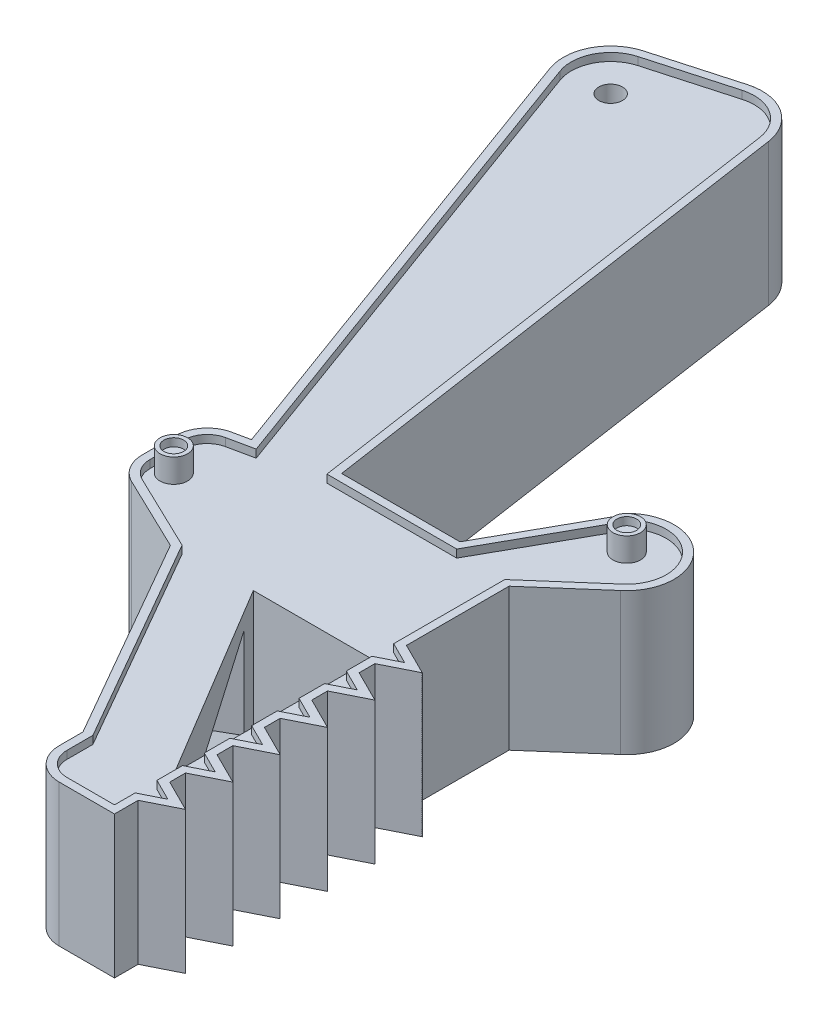
from build123d import *

# Parameters (mm, degrees)
BOSS_EXTRUDE1_DEPTH = 9
FILLET1_R           = 6
FILLET2_R           = 4
BOSS_EXTRUDE2_DEPTH = 18
LPATTERN1_COUNT     = 6
LPATTERN1_PITCH     = 6
CUT_EXTRUDE1_DEPTH  = 26
CUT_EXTRUDE2_DEPTH  = 12
SKETCH6_R           = 1.5
CUT_EXTRUDE3_DEPTH  = 137.617023851
SKETCH7_R           = 1.75
BOSS_EXTRUDE3_DEPTH = 3
SKETCH8_R           = 1.25
CUT_EXTRUDE4_DEPTH  = 1
SKETCH9_R           = 1.25
CUT_EXTRUDE5_DEPTH  = 1
CUT_EXTRUDE6_DEPTH  = 1
CUT_EXTRUDE8_DEPTH  = 1


with BuildPart() as part:
    # Sketch1 → Boss-Extrude1 (new, symmetric)
    with BuildSketch(Plane(origin=(0, 0, 0), x_dir=(1, 0, 0), z_dir=(0, 1, 0))):
        Polygon((-60.65446174, -6.500648573), (-36.587825561, -72.233418354), (-27.166266267, -70.236347784), (-37.55161412, 0), align=None)
        with BuildLine():
            ThreePointArc((-4.305064826, -56.165075387), (4.142121149, -56.968224871), (3.338971664, -65.415410847))
            Line((3.338971664, -65.415410847), (-4.18856152, -71.998437822))
            Line((-4.18856152, -71.998437822), (-4.18856152, -121.998437822))
            Line((-4.18856152, -121.998437822), (-15.18856152, -121.998437822))
            Line((-15.18856152, -121.998437822), (-15.18856152, -114.998437822))
            Line((-15.18856152, -114.998437822), (-30.124544277, -88.980820347))
            Line((-30.124544277, -88.980820347), (-41.840233878, -83.346761671))
            Line((-41.840233878, -83.346761671), (-41.840233878, -73.346761671))
            Line((-41.840233878, -73.346761671), (-27.166266267, -70.236347784))
            Line((-27.166266267, -70.236347784), (-12.168992483, -70.236347784))
            Line((-12.168992483, -70.236347784), (-4.305064826, -56.165075387))
        make_face()
    extrude(amount=BOSS_EXTRUDE1_DEPTH, both=True)

    # Fillet1
    fillet1_edges = [part.edges().sort_by_distance(p)[0] for p in [
        (-60.65446174, 0, 6.500648573),
        (-37.55161412, 0, 0),
    ]]
    fillet(fillet1_edges, radius=FILLET1_R)

    # Fillet2
    fillet2_edges = [part.edges().sort_by_distance(p)[0] for p in [
        (-15.18856152, 0, 121.998437822),
        (-41.840233878, 0, 83.346761671),
        (-41.840233878, 0, 73.346761671),
    ]]
    fillet(fillet2_edges, radius=FILLET2_R)

    # Sketch2 → Boss-Extrude2 (add)
    with BuildSketch(Plane(origin=(0, 9, 0), x_dir=(1, 0, 0), z_dir=(0, 1, 0))):
        Polygon((-4.18856152, -114.998437822), (-4.18856152, -118.998437822), (-0.18856152, -116.998437822), align=None)
    boss_extrude2 = extrude(amount=-BOSS_EXTRUDE2_DEPTH)

    # LPattern1: Boss-Extrude2 ×6
    with Locations(*[(0, 0, -i * LPATTERN1_PITCH) for i in range(1, LPATTERN1_COUNT)]):
        add(boss_extrude2)

    # Sketch3 → Cut-Extrude1 (cut)
    with BuildSketch(Plane(origin=(0, 9, 0), x_dir=(1, 0, 0), z_dir=(0, 1, 0))):
        Polygon((-5.910062362, -112.681899409), (-5.910062362, -87.681899409), (-20.910062362, -87.681899409), align=None)
    extrude(amount=-CUT_EXTRUDE1_DEPTH, mode=Mode.SUBTRACT)

    # Sketch5 → Cut-Extrude2 (cut)
    with BuildSketch(Plane(origin=(-61.077365003, 0, 35.062798175), x_dir=(0.49786609189148234, 0, 0.8672539158428183), z_dir=(-0.8672539158428184, 0, 0.4978660918914824))):
        Polygon((68.998311862, 6), (68.998311862, -5.607055646), (87.170975752, -0.946478308), (87.170975752, 1.339422662), align=None)
    extrude(amount=-CUT_EXTRUDE2_DEPTH, mode=Mode.SUBTRACT)

    # Sketch6 → Cut-Extrude3 (cut, through all)
    with BuildSketch(Plane(origin=(0, 9, 0), x_dir=(1, 0, 0), z_dir=(0, 1, 0))):
        with Locations(Location((-52.79279186, -10.521540216, 0), (0, 0, 270))):
            Circle(SKETCH6_R)
    extrude(amount=-CUT_EXTRUDE3_DEPTH, mode=Mode.SUBTRACT)

    # Sketch7 → Boss-Extrude3 (add)
    with BuildSketch(Plane(origin=(0, 9, 0), x_dir=(1, 0, 0), z_dir=(0, 1, 0))):
        with Locations(Location((-37.840233878, -80.83186359, 0), (0, 0, 270))):
            Circle(SKETCH7_R)
        with Locations(Location((-0.483046581, -60.790243117, 0), (0, 0, 270))):
            Circle(SKETCH7_R)
    boss_extrude3 = extrude(amount=BOSS_EXTRUDE3_DEPTH)

    # Sketch8 → Cut-Extrude4 (cut)
    with BuildSketch(Plane(origin=(0, 12, 0), x_dir=(1, 0, 0), z_dir=(0, 1, 0))):
        with Locations(Location((-37.840233878, -80.83186359, 0), (0, 0, 270))):
            Circle(SKETCH8_R)
    cut_extrude4 = extrude(amount=-CUT_EXTRUDE4_DEPTH, mode=Mode.SUBTRACT)

    # Sketch9 → Cut-Extrude5 (cut)
    with BuildSketch(Plane(origin=(0, 12, 0), x_dir=(1, 0, 0), z_dir=(0, 1, 0))):
        with Locations(Location((-0.483046581, -60.790243117, 0), (0, 0, 270))):
            Circle(SKETCH9_R)
    cut_extrude5 = extrude(amount=-CUT_EXTRUDE5_DEPTH, mode=Mode.SUBTRACT)

    # Sketch10 → Cut-Extrude6 (cut)
    with BuildSketch(Plane(origin=(0, 9, 0), x_dir=(1, 0, 0), z_dir=(0, 1, 0))):
        with BuildLine():
            Line((-14.18856152, -114.731807726), (-14.18856152, -117.998437822))
            ThreePointArc((-14.18856152, -117.998437822), (-13.309881864, -120.119758166), (-11.18856152, -120.998437822))
            Line((-11.18856152, -120.998437822), (-5.18856152, -120.998437822))
            Line((-5.18856152, -120.998437822), (-5.18856152, -118.380403833))
            Line((-5.18856152, -118.380403833), (-2.424629498, -116.998437822))
            Line((-2.424629498, -116.998437822), (-5.18856152, -115.616471811))
            Line((-5.18856152, -115.616471811), (-5.18856152, -112.380403833))
            Line((-5.18856152, -112.380403833), (-2.424629498, -110.998437822))
            Line((-2.424629498, -110.998437822), (-5.18856152, -109.616471811))
            Line((-5.18856152, -109.616471811), (-5.18856152, -106.380403833))
            Line((-5.18856152, -106.380403833), (-2.424629498, -104.998437822))
            Line((-2.424629498, -104.998437822), (-5.18856152, -103.616471811))
            Line((-5.18856152, -103.616471811), (-5.18856152, -100.380403833))
            Line((-5.18856152, -100.380403833), (-2.424629498, -98.998437822))
            Line((-2.424629498, -98.998437822), (-5.18856152, -97.616471811))
            Line((-5.18856152, -97.616471811), (-5.18856152, -94.380403833))
            Line((-5.18856152, -94.380403833), (-2.424629498, -92.998437822))
            Line((-2.424629498, -92.998437822), (-5.18856152, -91.616471811))
            Line((-5.18856152, -91.616471811), (-5.18856152, -88.380403833))
            Line((-5.18856152, -88.380403833), (-2.424629498, -86.998437822))
            Line((-2.424629498, -86.998437822), (-5.18856152, -85.616471811))
            Line((-5.18856152, -85.616471811), (-5.18856152, -71.544507837))
            Line((-5.18856152, -71.544507837), (2.691671648, -64.653035393))
            ThreePointArc((2.691671648, -64.653035393), (3.431869226, -57.680028619), (-3.527901716, -56.824280786))
            Line((-3.527901716, -56.824280786), (-11.582287208, -71.236347784))
            Line((-11.582287208, -71.236347784), (-28.029276006, -71.236347784))
            Line((-28.029276006, -71.236347784), (-37.543545046, -6.891126164))
            ThreePointArc((-37.543545046, -6.891126164), (-39.771200268, -3.426133551), (-43.844068507, -2.809395435))
            Line((-43.844068507, -2.809395435), (-54.147093646, -5.708446962))
            ThreePointArc((-54.147093646, -5.708446962), (-57.244344446, -8.244770667), (-57.487989702, -12.240585657))
            Line((-57.487989702, -12.240585657), (-35.252291992, -72.972546184))
            Line((-35.252291992, -72.972546184), (-38.462316656, -73.6529692))
            ThreePointArc((-38.462316656, -73.6529692), (-40.171140175, -74.699145282), (-40.840233878, -76.587762722))
            Line((-40.840233878, -76.587762722), (-40.840233878, -80.83186359))
            ThreePointArc((-40.840233878, -80.83186359), (-40.379968329, -82.428656914), (-39.140401265, -83.535484267))
            Line((-39.140401265, -83.535484267), (-29.411682997, -88.214011219))
            Line((-29.411682997, -88.214011219), (-14.18856152, -114.731807726))
        make_face()
    extrude(amount=-CUT_EXTRUDE6_DEPTH, mode=Mode.SUBTRACT)


with BuildPart() as cut_extrude6_piece_1:
    # of the separate pieces the step leaves, piece 1, a body of its own (cut_extrude6_pieces)
    add(part.part.solids().sort_by_distance((-38.669677582, -9, 72.674704692))[0])

    # Mirror4: Boss-Extrude3, Cut-Extrude4, Cut-Extrude5 across plane
    add(boss_extrude3.mirror(Plane.ZX))
    add(cut_extrude4.mirror(Plane.ZX), mode=Mode.SUBTRACT)
    add(cut_extrude5.mirror(Plane.ZX), mode=Mode.SUBTRACT)

    # Sketch12 → Cut-Extrude8 (cut)
    with BuildSketch(Plane.XZ.offset(9)):
        with BuildLine():
            Line((-5.18856152, 120.998437822), (-11.18856152, 120.998437822))
            ThreePointArc((-11.18856152, 120.998437822), (-13.309881864, 120.119758166), (-14.18856152, 117.998437822))
            Line((-14.18856152, 117.998437822), (-14.18856152, 114.731807726))
            Line((-14.18856152, 114.731807726), (-29.411682997, 88.214011219))
            Line((-29.411682997, 88.214011219), (-39.140401265, 83.535484267))
            ThreePointArc((-39.140401265, 83.535484267), (-40.379968329, 82.428656914), (-40.840233878, 80.83186359))
            Line((-40.840233878, 80.83186359), (-40.840233878, 76.587762722))
            ThreePointArc((-40.840233878, 76.587762722), (-40.171140175, 74.699145282), (-38.462316656, 73.6529692))
            Line((-38.462316656, 73.6529692), (-35.252291992, 72.972546184))
            Line((-35.252291992, 72.972546184), (-57.487989702, 12.240585657))
            ThreePointArc((-57.487989702, 12.240585657), (-57.244344446, 8.244770667), (-54.147093646, 5.708446962))
            Line((-54.147093646, 5.708446962), (-43.844068507, 2.809395435))
            ThreePointArc((-43.844068507, 2.809395435), (-39.771200268, 3.426133551), (-37.543545046, 6.891126164))
            Line((-37.543545046, 6.891126164), (-28.029276006, 71.236347784))
            Line((-28.029276006, 71.236347784), (-11.582287208, 71.236347784))
            Line((-11.582287208, 71.236347784), (-3.527901716, 56.824280786))
            ThreePointArc((-3.527901716, 56.824280786), (3.431869226, 57.680028619), (2.691671648, 64.653035393))
            Line((2.691671648, 64.653035393), (-5.18856152, 71.544507837))
            Line((-5.18856152, 71.544507837), (-5.18856152, 85.616471811))
            Line((-5.18856152, 85.616471811), (-2.424629498, 86.998437822))
            Line((-2.424629498, 86.998437822), (-5.18856152, 88.380403833))
            Line((-5.18856152, 88.380403833), (-5.18856152, 91.616471811))
            Line((-5.18856152, 91.616471811), (-2.424629498, 92.998437822))
            Line((-2.424629498, 92.998437822), (-5.18856152, 94.380403833))
            Line((-5.18856152, 94.380403833), (-5.18856152, 97.616471811))
            Line((-5.18856152, 97.616471811), (-2.424629498, 98.998437822))
            Line((-2.424629498, 98.998437822), (-5.18856152, 100.380403833))
            Line((-5.18856152, 100.380403833), (-5.18856152, 103.616471811))
            Line((-5.18856152, 103.616471811), (-2.424629498, 104.998437822))
            Line((-2.424629498, 104.998437822), (-5.18856152, 106.380403833))
            Line((-5.18856152, 106.380403833), (-5.18856152, 109.616471811))
            Line((-5.18856152, 109.616471811), (-2.424629498, 110.998437822))
            Line((-2.424629498, 110.998437822), (-5.18856152, 112.380403833))
            Line((-5.18856152, 112.380403833), (-5.18856152, 115.616471811))
            Line((-5.18856152, 115.616471811), (-2.424629498, 116.998437822))
            Line((-2.424629498, 116.998437822), (-5.18856152, 118.380403833))
            Line((-5.18856152, 118.380403833), (-5.18856152, 120.998437822))
        make_face()
    extrude(amount=-CUT_EXTRUDE8_DEPTH, mode=Mode.SUBTRACT)


with BuildPart() as cut_extrude6_piece_2:
    # of the separate pieces the step leaves, piece 2, a body of its own (cut_extrude6_pieces)
    add(part.part.solids().sort_by_distance((-37.840233878, 9, 82.58186359))[0])


with BuildPart() as cut_extrude6_piece_3:
    # of the separate pieces the step leaves, piece 3, a body of its own (cut_extrude6_pieces)
    add(part.part.solids().sort_by_distance((-0.483046581, 9, 62.540243117))[0])


with BuildPart() as cut_extrude8_piece_1:
    # of the separate pieces the step leaves, piece 1, a body of its own (cut_extrude8_pieces)
    add(cut_extrude6_piece_1.part.solids().sort_by_distance((-38.669677582, -9, 72.674704692))[0])


with BuildPart() as cut_extrude8_piece_2:
    # of the separate pieces the step leaves, piece 2, a body of its own (cut_extrude8_pieces)
    add(cut_extrude6_piece_1.part.solids().sort_by_distance((-37.840233878, -9, 82.58186359))[0])


with BuildPart() as cut_extrude8_piece_3:
    # of the separate pieces the step leaves, piece 3, a body of its own (cut_extrude8_pieces)
    add(cut_extrude6_piece_1.part.solids().sort_by_distance((-0.483046581, -9, 62.540243117))[0])


solid = Compound([cut_extrude6_piece_2.part, cut_extrude6_piece_3.part, cut_extrude8_piece_1.part, cut_extrude8_piece_2.part, cut_extrude8_piece_3.part])
